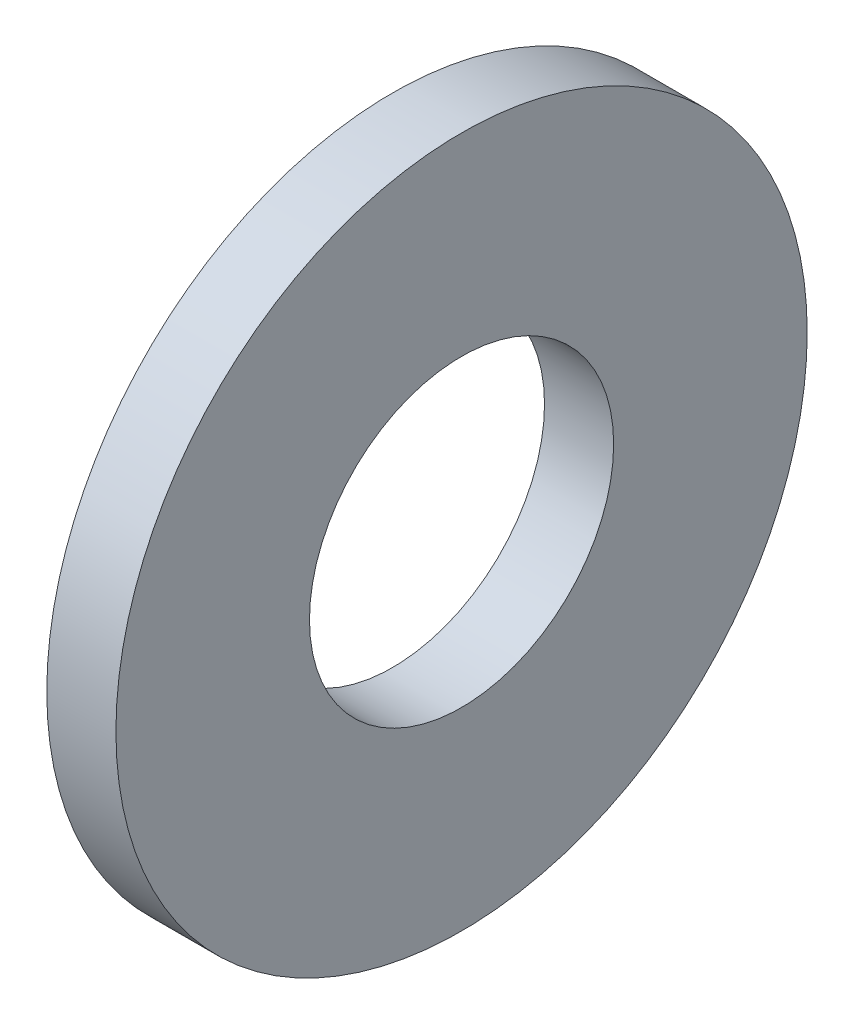
from build123d import *

# Parameters (mm, degrees)
SKETCH1_R          = 10
SKETCH1_R_2        = 4.4
BASE_EXTRUDE_DEPTH = 2


with BuildPart() as part:
    # Sketch1 → Base-Extrude (new body)
    with BuildSketch(Plane(origin=(0, 0, 0), x_dir=(0, 0, -1), z_dir=(1, 0, 0))):
        Circle(SKETCH1_R)
        Circle(SKETCH1_R_2, mode=Mode.SUBTRACT)
    extrude(amount=BASE_EXTRUDE_DEPTH)


solid = part.part
